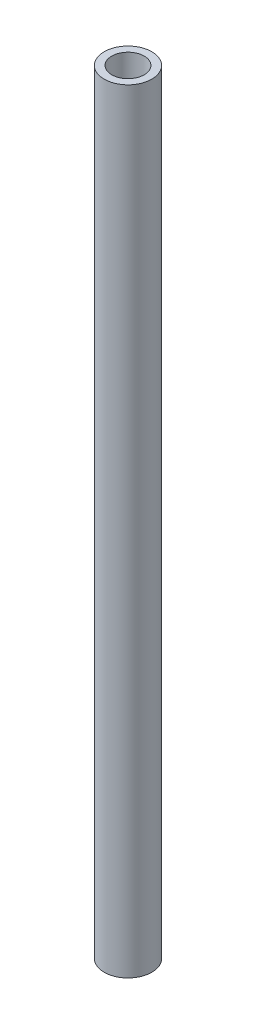
from build123d import *

# Parameters (mm, degrees)
SKETCH1_R           = 4
BOSS_EXTRUDE1_DEPTH = 130
SHELL1_T            = -1.27


with BuildPart() as part:
    # Sketch1 → Boss-Extrude1 (new body)
    with BuildSketch(Plane(origin=(0, 0, 0), x_dir=(1, 0, 0), z_dir=(0, 1, 0))):
        with Locations(Location((0, 0, 0), (0, 0, 270))):
            Circle(SKETCH1_R)
    extrude(amount=BOSS_EXTRUDE1_DEPTH)

    # Shell1
    shell1_openings = [part.faces().sort_by_distance(p)[0] for p in [
        (0, 130, 0),
        (0, 0, 0),
    ]]
    offset(amount=SHELL1_T, openings=shell1_openings, kind=Kind.INTERSECTION)


solid = part.part
